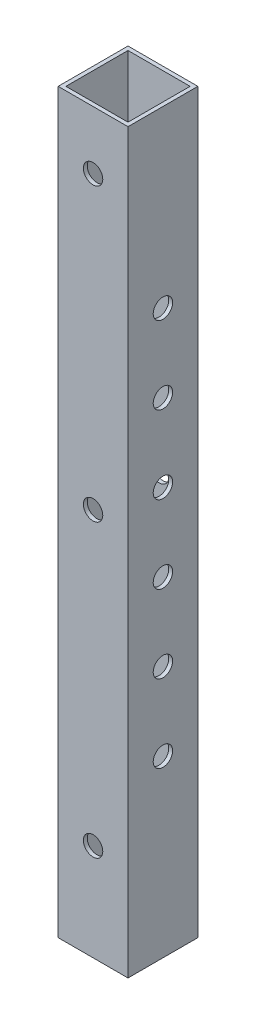
from build123d import *

# Parameters (mm, degrees)
SKETCH1_W                 = 45.72
SKETCH1_H                 = 482.6
BOSS_EXTRUDE1_DEPTH       = 45.72
SHELL1_T                  = -2.54
SKETCH5_W                 = 40.64
SKETCH5_H                 = 40.64
CUT_EXTRUDE1_DEPTH        = 2.54
F_97_0_5_DIAMETER_HOLE1_D = 12.7
F_97_0_5_DIAMETER_HOLE2_D = 12.7


with BuildPart() as part:
    # Sketch1 → Boss-Extrude1 (new body)
    with BuildSketch(Plane.XY):
        with Locations((22.86, -241.3)):
            Rectangle(SKETCH1_W, SKETCH1_H)
    extrude(amount=BOSS_EXTRUDE1_DEPTH)

    # Shell1
    shell1_openings = [part.faces().sort_by_distance(p)[0] for p in [
        (22.86, 0, 22.86),
    ]]
    offset(amount=SHELL1_T, openings=shell1_openings, kind=Kind.INTERSECTION)

    # Sketch5 → Cut-Extrude1 (cut)
    with BuildSketch(Plane.XZ.offset(482.6)):
        with Locations((22.86, 22.86)):
            Rectangle(SKETCH5_W, SKETCH5_H)
    extrude(amount=-CUT_EXTRUDE1_DEPTH, mode=Mode.SUBTRACT)

    # #97 (0.5) Diameter Hole1 (through all)
    with Locations(Plane(origin=(22.86, -38.1, 45.72), x_dir=(1, 0, 0), z_dir=(0, 0, 1))):
        with Locations((0, 0), (0, -190.5), (0, -381)):
            Hole(F_97_0_5_DIAMETER_HOLE1_D / 2)

    # #97 (0.5) Diameter Hole2 (through all)
    with Locations(Plane(origin=(45.72, -114.3, 22.86), x_dir=(0, 1, 0), z_dir=(1, 0, 0))):
        with Locations((0, 0), (-50.8, 0), (-101.6, 0), (-152.4, 0), (-203.2, 0), (-254, 0)):
            Hole(F_97_0_5_DIAMETER_HOLE2_D / 2)


solid = part.part
